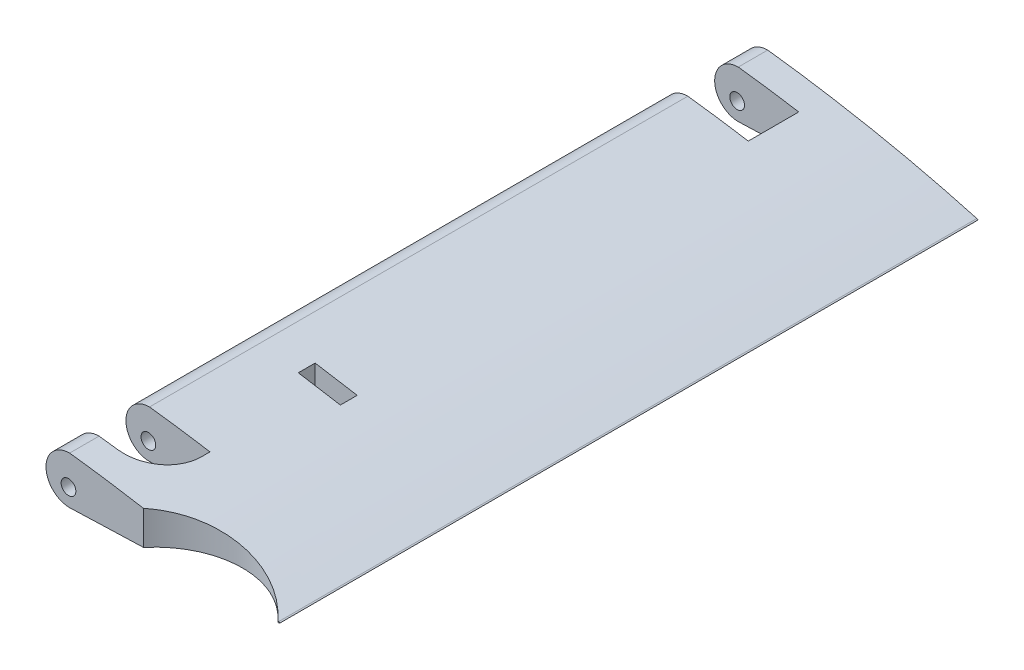
from build123d import *

# Parameters (mm, degrees)
EXTRUDE_1_DEPTH          = 185
SKETCH_2_R               = 3.25
CUT_EXTRUDE_1_DEPTH      = 221.978766148
CUT_EXTRUDE_2_DEPTH      = 221.978766148
CUT_EXTRUDE_2_DEPTH_BACK = 221.978766148
EXTRUDE_2_DEPTH          = 166
SKETCH_6_R               = 1.75
CUT_EXTRUDE_3_DEPTH      = 206.235651098
CUT_EXTRUDE_4_DEPTH      = 216.057370215
CUT_EXTRUDE_4_DEPTH_BACK = 216.057370215
SKETCH_7_W               = 10
SKETCH_7_H               = 4
SKETCH_7_W_2             = 20
SKETCH_7_H_2             = 12
CUT_EXTRUDE_6_DEPTH      = 216.057370215
CUT_EXTRUDE_6_DEPTH_BACK = 216.057370215
SKETCH_9_R               = 21.288089845
FILLET_1_R               = 10
CUT_EXTRUDE_7_DEPTH      = 216.057370215
CUT_EXTRUDE_7_DEPTH_BACK = 216.057370215
SKETCH_10_W              = 131.862642568
SKETCH_10_H              = 171.330673695


with BuildPart() as part:
    # 草圖4 → 填料-伸長1 (new body)
    with BuildSketch(Plane.XY):
        with BuildLine():
            add(Edge.make_bspline(
                [(120, 0.156), (120.550064826, 0), (120, -0.156)],
                knots=[0, 0, 0, 1, 1, 1], degree=2))
            add(Edge.make_bspline(
                [(120, 0.156), (118.002062038, 0.699883829), (114.015827899, 1.785026774), (106.030245524, 3.758084328), (96.043999536, 5.938072944), (84.032443886, 8.087020219), (72.030199863, 9.848487706), (60.021268297, 11.104941512), (48.013383082, 11.888579605), (37.989056271, 11.896504921), (29.98519837, 11.342771412), (23.974194566, 10.613404695), (17.950199351, 9.537800408), (12.958326827, 8.244233687), (8.958076554, 6.937785184), (5.941795374, 5.704437414), (3.368139922, 4.370604372), (1.134204878, 2.77510484), (-0.810450078, 0.209036715), (1.28854905, -1.753439419), (3.430370135, -2.523784281), (5.981131747, -3.043733145), (8.993574888, -3.308089705), (12.998336856, -3.495180047), (18.001252309, -3.481166853), (24.002604177, -3.313228981), (29.999721531, -2.993463999), (37.999752898, -2.619308415), (47.998084378, -2.139166009), (60.000346089, -1.688308544), (71.998752124, -1.187669763), (83.99830623, -0.761253895), (95.998821653, -0.44759827), (105.999699706, -0.288346287), (113.999817607, -0.183470629), (117.999975201, -0.165156712), (120, -0.156)],
                knots=[0, 0, 0, 0, 0.025304886, 0.050487653, 0.100520433, 0.150190716, 0.199586607, 0.248740009, 0.297715539, 0.346600594, 0.371102737, 0.395726297, 0.420570145, 0.445825119, 0.458702216, 0.471919982, 0.485786003, 0.493461051, 0.506863029, 0.51614777, 0.522766003, 0.535269014, 0.547551134, 0.559786371, 0.584228898, 0.60868081, 0.633151284, 0.657621757, 0.706558114, 0.75548187, 0.804405627, 0.853320224, 0.902221408, 0.951113136, 0.975557228, 1, 1, 1, 1], degree=3))
        make_face()
    extrude(amount=EXTRUDE_1_DEPTH)

    # 草圖2 → 除料-伸長1 (cut, through all)
    with BuildSketch(Plane(origin=(0, 0, 0), x_dir=(-1, 0, 0), z_dir=(0, 0, -1))):
        with Locations((-25, 5)):
            Circle(SKETCH_2_R)
        with Locations((-50, 5)):
            Circle(SKETCH_2_R)
    extrude(amount=-CUT_EXTRUDE_1_DEPTH, mode=Mode.SUBTRACT)

    # 草圖3 → 除料-伸長2 (cut, two sides: drawn at the far end of the back side and taken through both)
    with BuildSketch(Plane(origin=(0, 0, 0), x_dir=(1, 0, 0), z_dir=(0, 1, 0)).offset(-CUT_EXTRUDE_2_DEPTH_BACK)):
        Polygon((70.275032413, -12), (120.275032413, -12), (166.480451747, 19.353311424), (-21.771072244, 70.933366938), (-60.731552483, -48.361554858), (-45.023238503, -192.444996011), (84.857900861, -230.57523876), (139.860309741, -200.53846228), (120.275032413, -178), (70.275032413, -178), align=None)
    extrude(amount=CUT_EXTRUDE_2_DEPTH + CUT_EXTRUDE_2_DEPTH_BACK, mode=Mode.SUBTRACT)

    # 草圖5 → 填料-伸長2 (add, through all)
    with BuildSketch(Plane.XY.offset(178)):
        with BuildLine():
            Line((70.275032413, 9.979427787), (70.275032413, -1.267341491))
            ThreePointArc((70.275032413, -1.267341491), (64.651647774, 4.356043148), (70.275032413, 9.979427787))
        make_face()
    extrude(amount=-EXTRUDE_2_DEPTH)

    # 草圖6 → 除料-伸長3 (cut, through all)
    with BuildSketch(Plane.XY.offset(178)):
        with Locations((70, 2.844)):
            Circle(SKETCH_6_R)
    extrude(amount=-CUT_EXTRUDE_3_DEPTH, mode=Mode.SUBTRACT)

    # 草圖7 → 除料-伸長4 (cut, two sides: drawn at the far end of the back side and taken through both)
    with BuildSketch(Plane(origin=(0, 0, 0), x_dir=(1, 0, 0), z_dir=(0, 1, 0)).offset(-CUT_EXTRUDE_4_DEPTH_BACK)):
        with Locations((84.651647774, -59)):
            Rectangle(SKETCH_7_W, SKETCH_7_H)
        with Locations((74.651647774, -25)):
            Rectangle(SKETCH_7_W_2, SKETCH_7_H_2)
        with Locations((74.651647774, -165)):
            Rectangle(SKETCH_7_W_2, SKETCH_7_H_2)
    extrude(amount=CUT_EXTRUDE_4_DEPTH + CUT_EXTRUDE_4_DEPTH_BACK, mode=Mode.SUBTRACT)

    # 草圖9 → 除料-伸長6 (cut, two sides: drawn at the far end of the back side and taken through both)
    with BuildSketch(Plane(origin=(0, 0, 0), x_dir=(1, 0, 0), z_dir=(0, 1, 0)).offset(-CUT_EXTRUDE_6_DEPTH_BACK)):
        with Locations((103.803043975, 2.084988425)):
            Circle(SKETCH_9_R)
    extrude(amount=CUT_EXTRUDE_6_DEPTH + CUT_EXTRUDE_6_DEPTH_BACK, mode=Mode.SUBTRACT)

    # 圓角1
    fillet_1_edges = [part.edges().sort_by_distance(p)[0] for p in [
        (84.651647774, 3.58065081, 19),
    ]]
    fillet(fillet_1_edges, radius=FILLET_1_R)

    # 鏡射1: part across plane


with BuildPart() as part_1:
    add(part.part)
    add(part.part.mirror(Plane(origin=(70.275032413, -3.495180047, 12), x_dir=(1, 0, 0), z_dir=(0, 0, 1))))

    # 草圖10 → 除料-伸長7 (cut, two sides: drawn at the far end of the back side and taken through both)
    with BuildSketch(Plane(origin=(0, 0, 0), x_dir=(1, 0, 0), z_dir=(0, 1, 0)).offset(-CUT_EXTRUDE_7_DEPTH_BACK)):
        with Locations((93.155972117, -97.665336848)):
            Rectangle(SKETCH_10_W, SKETCH_10_H)
    extrude(amount=CUT_EXTRUDE_7_DEPTH + CUT_EXTRUDE_7_DEPTH_BACK, mode=Mode.SUBTRACT)


solid = part_1.part
